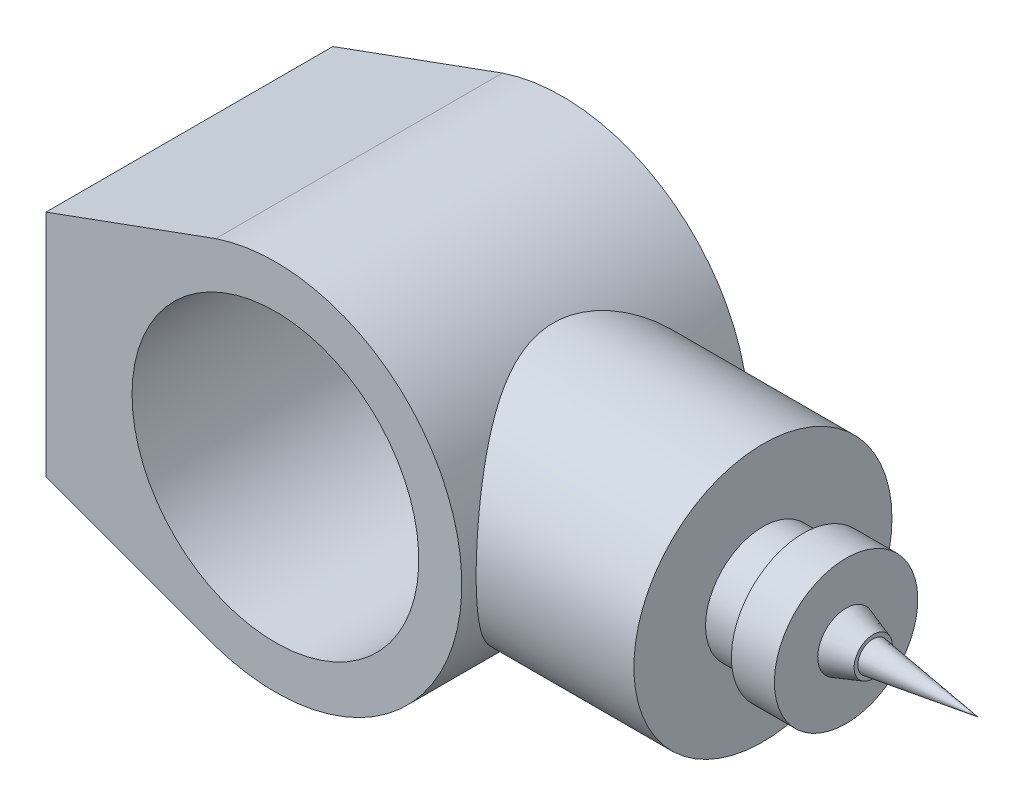
from build123d import *

# Parameters (mm, degrees)
SKETCH1_R           = 1270
BOSS_EXTRUDE1_DEPTH = 1270
BOSS_EXTRUDE2_REACH = 5492.455
SKETCH2_R           = 1143


with BuildPart() as part:
    # Sketch1 → Boss-Extrude1 (new, symmetric)
    with BuildSketch(Plane.XY):
        with BuildLine():
            Line((-2032, 1016), (-2032, -1016))
            Line((-2032, -1016), (-528.898626564, -1563.990806501))
            ThreePointArc((-528.898626564, -1563.990806501), (1651, 0), (-528.898626564, 1563.990806501))
            Line((-528.898626564, 1563.990806501), (-2032, 1016))
        make_face()
        Circle(SKETCH1_R, mode=Mode.SUBTRACT)
    extrude(amount=BOSS_EXTRUDE1_DEPTH, both=True)

    # Sketch2 → Boss-Extrude2 (add, up to next)
    with BuildSketch(Plane(origin=(3048, 0, 0), x_dir=(0, 0, -1), z_dir=(1, 0, 0)), mode=Mode.PRIVATE) as boss_extrude2_sk1:
        Circle(SKETCH2_R)
    boss_extrude2_tool1 = extrude(boss_extrude2_sk1.sketch, amount=-BOSS_EXTRUDE2_REACH, mode=Mode.PRIVATE) - part.part
    add(boss_extrude2_tool1.solids().sort_by_distance((3048, 0, 0))[0])

    # Sketch3 → Revolve1 (revolve)
    with BuildSketch(Plane.XY):
        Polygon((3048, 0), (3048, -508), (3403.6, -508), (3403.6, -635), (3784.6, -635), (3784.6, -251.300483092), (4025.013587797, -169.341305434), (4022.871127105, -134.477952869), (4953, 0), align=None)
    revolve(axis=Axis((0, 0, 0), (1, 0, 0)))


solid = part.part
